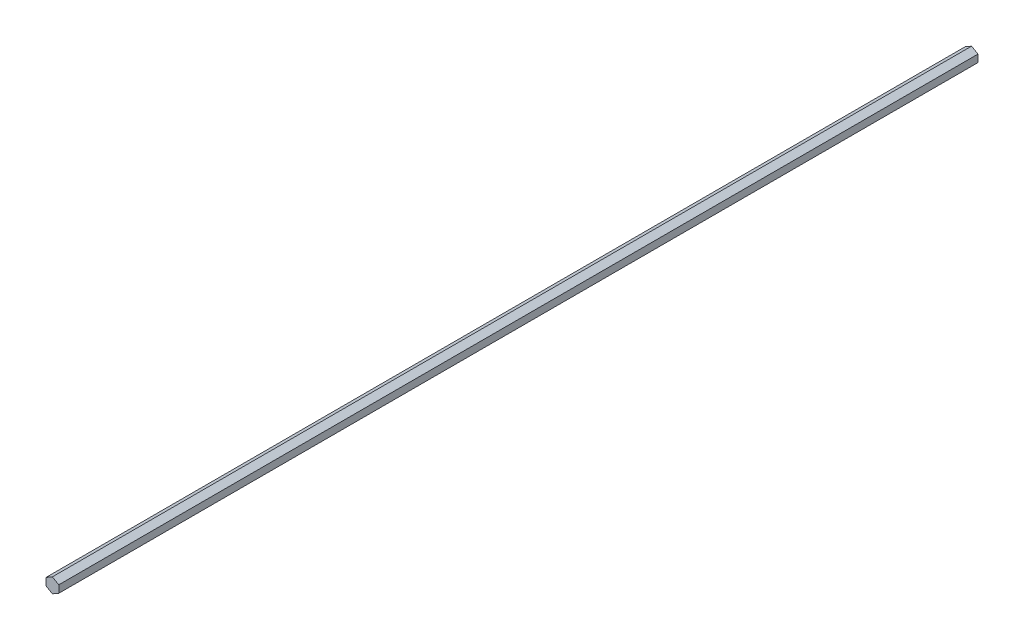
from build123d import *

# Parameters (mm, degrees)
BOSS_EXTRUDE2_DEPTH      = 457.2
BOSS_EXTRUDE2_DEPTH_BACK = 457.2


with BuildPart() as part:
    # Sketch3 → Boss-Extrude2 (new, two sides: drawn at the far end of the back side and taken through both)
    with BuildSketch(Plane.XY.offset(-BOSS_EXTRUDE2_DEPTH_BACK)):
        Polygon((-6.35, -3.666174209), (0, -7.332348419), (6.35, -3.666174209), (6.35, 3.666174209), (0, 7.332348419), (-6.35, 3.666174209), align=None)
    extrude(amount=BOSS_EXTRUDE2_DEPTH + BOSS_EXTRUDE2_DEPTH_BACK)


solid = part.part
